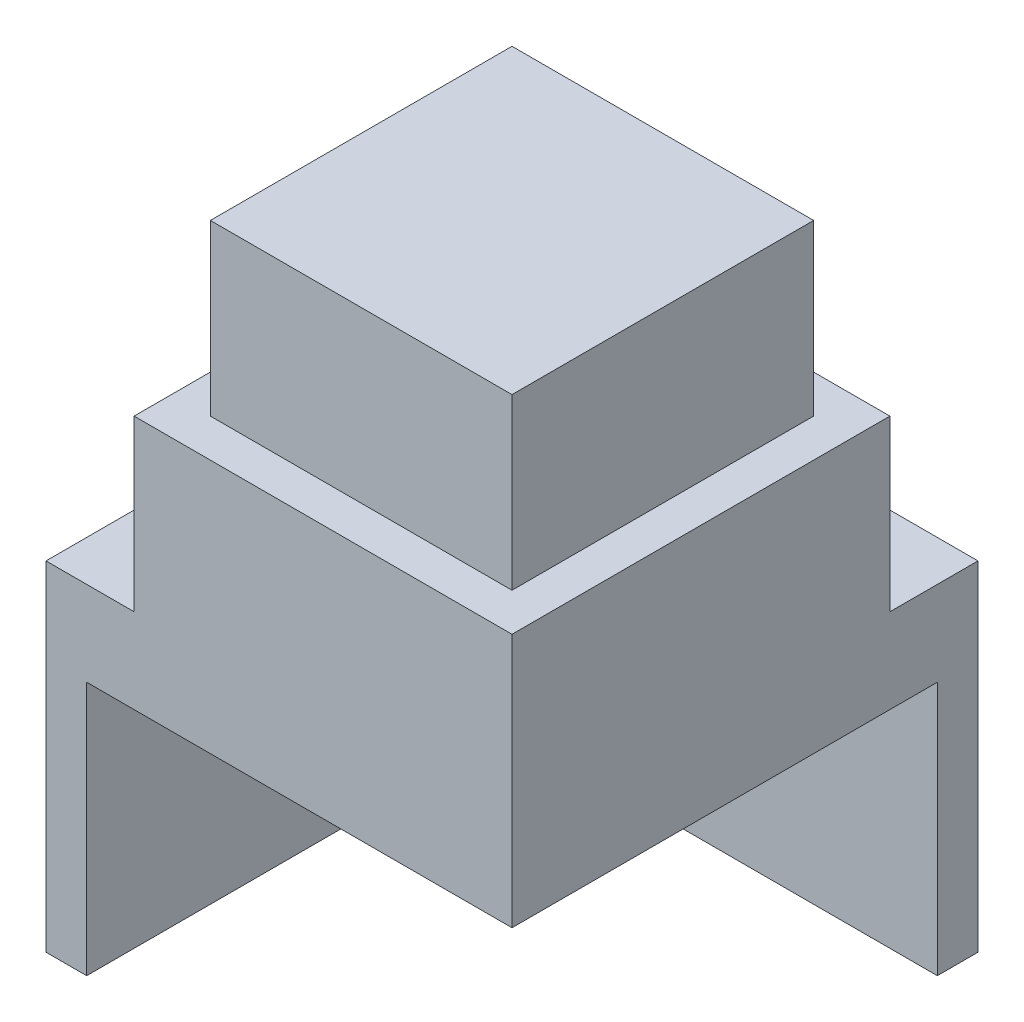
from build123d import *

# Parameters (mm, degrees)
SKETCH1_W           = 27.5
SKETCH1_H           = 27.5
BOSS_EXTRUDE3_DEPTH = 15
CUT_EXTRUDE1_DEPTH  = 10
SKETCH4_W           = 17.8
SKETCH4_H           = 17.8
BOSS_EXTRUDE4_DEPTH = 10
BOSS_EXTRUDE5_DEPTH = 15


with BuildPart() as part:
    # Sketch1 → Boss-Extrude3 (new body)
    with BuildSketch(Plane(origin=(0, 0, 0), x_dir=(1, 0, 0), z_dir=(0, 1, 0))):
        Rectangle(SKETCH1_W, SKETCH1_H)
    extrude(amount=BOSS_EXTRUDE3_DEPTH)

    # Sketch3 → Cut-Extrude1 (cut)
    with BuildSketch(Plane(origin=(0, 15, 0), x_dir=(1, 0, 0), z_dir=(0, 1, 0))):
        Polygon((-13.75, -13.75), (-8.55, -13.75), (-8.55, 8.55), (13.75, 8.55), (13.75, 13.75), (-13.75, 13.75), align=None)
    extrude(amount=-CUT_EXTRUDE1_DEPTH, mode=Mode.SUBTRACT)

    # Sketch4 → Boss-Extrude4 (add)
    with BuildSketch(Plane(origin=(0, 15, 0), x_dir=(1, 0, 0), z_dir=(0, 1, 0))):
        with Locations((2.6, -2.6)):
            Rectangle(SKETCH4_W, SKETCH4_H)
    extrude(amount=BOSS_EXTRUDE4_DEPTH)

    # Sketch6 → Boss-Extrude5 (add)
    with BuildSketch(Plane.XZ):
        Polygon((-11.35, -11.35), (-11.35, 13.75), (-13.75, 13.75), (-13.75, -13.75), (13.75, -13.75), (13.75, -11.35), align=None)
    extrude(amount=BOSS_EXTRUDE5_DEPTH)


solid = part.part
